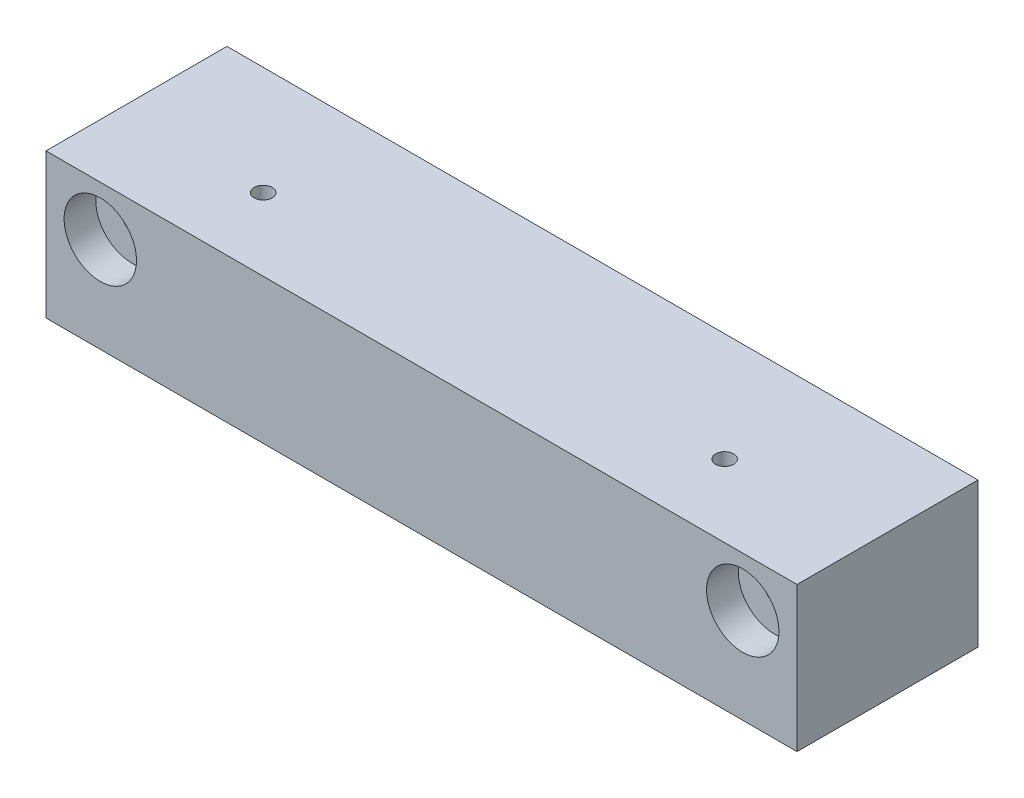
from build123d import *

# Parameters (mm, degrees)
SKETCH_1_W          = 83
SKETCH_1_H          = 20
EXTRUDE_1_DEPTH     = 16
SKETCH_2_R          = 4
CUT_EXTRUDE_1_DEPTH = 3.5
SKETCH_3_R          = 1
CUT_EXTRUDE_2_DEPTH = 10
SKETCH_6_R          = 1
CUT_EXTRUDE_5_DEPTH = 8


with BuildPart() as part:
    # 스케치1 → 보스-돌출1 (new body)
    with BuildSketch(Plane(origin=(0, 0, 0), x_dir=(1, 0, 0), z_dir=(0, 1, 0))):
        Rectangle(SKETCH_1_W, SKETCH_1_H)
    extrude(amount=EXTRUDE_1_DEPTH)

    # 스케치2 → 컷-돌출1 (cut)
    with BuildSketch(Plane.XY.offset(10)):
        with Locations((-35.5, 10.5)):
            Circle(SKETCH_2_R)
        with Locations((35.5, 10.5)):
            Circle(SKETCH_2_R)
    extrude(amount=-CUT_EXTRUDE_1_DEPTH, mode=Mode.SUBTRACT)

    # 스케치3 → 컷-돌출2 (cut)
    with BuildSketch(Plane(origin=(0, 16, 0), x_dir=(1, 0, 0), z_dir=(0, 1, 0))):
        with Locations(Location((-25.5, -2, 0), (0, 0, 270))):
            Circle(SKETCH_3_R)
        with Locations(Location((25.5, -2, 0), (0, 0, 270))):
            Circle(SKETCH_3_R)
    extrude(amount=-CUT_EXTRUDE_2_DEPTH, mode=Mode.SUBTRACT)

    # 스케치6 → 컷-돌출5 (cut)
    with BuildSketch(Plane.XY.offset(6.5)):
        with Locations((-35.5, 10.5)):
            Circle(SKETCH_6_R)
        with Locations((35.5, 10.5)):
            Circle(SKETCH_6_R)
    extrude(amount=-CUT_EXTRUDE_5_DEPTH, mode=Mode.SUBTRACT)


solid = part.part
